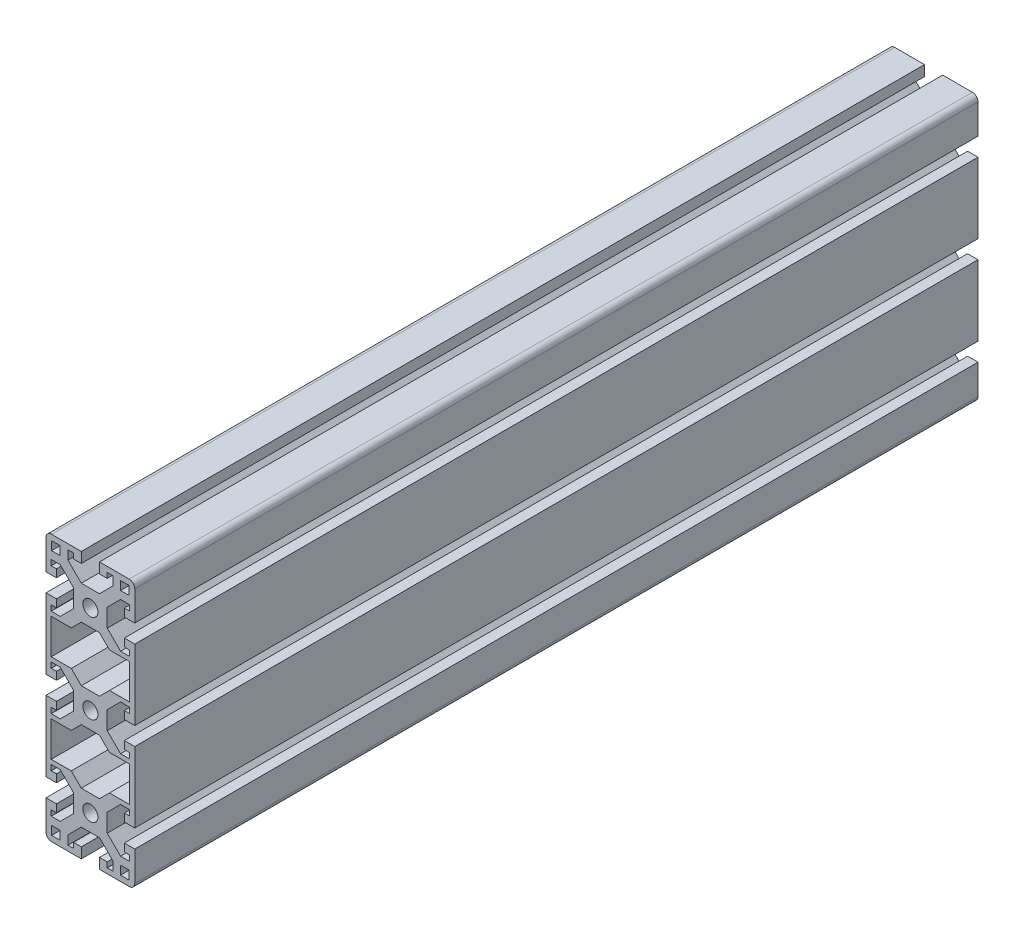
from build123d import *

# Parameters (mm, degrees)
SKETCH2_W                       = 3.9
SKETCH2_H                       = 3.9
F_40_SERIES_TS40_120LM_1_DEPTH  = 380
M8X1_25_TAPPED_HOLE1_AT_2_COUNT = 2
M8X1_25_TAPPED_HOLE1_AT_2_PITCH = 40
M8X1_25_TAPPED_HOLE1_AT_3_COUNT = 2
M8X1_25_TAPPED_HOLE1_AT_3_PITCH = 80


with BuildPart() as part:
    # Sketch2 → 40 series TS40-120LM(1) (new body)
    with BuildSketch(Plane.XY.offset(-190)):
        with BuildLine():
            Line((15.3, -35.9), (20, -35.9))
            Line((20, -35.9), (20, -4.1))
            Line((20, -4.1), (15.3, -4.1))
            Line((15.3, -4.1), (15.3, -7.6))
            Line((15.3, -7.6), (17.65, -7.6))
            Line((17.65, -7.6), (17.65, -10.1))
            Line((17.65, -10.1), (13.6, -10.1))
            Line((13.6, -10.1), (7.6, -4.1))
            Line((7.6, -4.1), (7.6, 4.1))
            Line((7.6, 4.1), (13.6, 10.1))
            Line((13.6, 10.1), (17.65, 10.1))
            Line((17.65, 10.1), (17.65, 7.6))
            Line((17.65, 7.6), (15.3, 7.6))
            Line((15.3, 7.6), (15.3, 4.1))
            Line((15.3, 4.1), (20, 4.1))
            Line((20, 4.1), (20, 35.9))
            Line((20, 35.9), (15.3, 35.9))
            Line((15.3, 35.9), (15.3, 32.4))
            Line((15.3, 32.4), (17.65, 32.4))
            Line((17.65, 32.4), (17.65, 29.9))
            Line((17.65, 29.9), (13.6, 29.9))
            Line((13.6, 29.9), (7.6, 35.9))
            Line((7.6, 35.9), (7.6, 44.1))
            Line((7.6, 44.1), (13.6, 50.1))
            Line((13.6, 50.1), (17.65, 50.1))
            Line((17.65, 50.1), (17.65, 47.6))
            Line((17.65, 47.6), (15.3, 47.6))
            Line((15.3, 47.6), (15.3, 44.1))
            Line((15.3, 44.1), (20, 44.1))
            Line((20, 44.1), (20, 57.5))
            ThreePointArc((20, 57.5), (19.267766953, 59.267766953), (17.5, 60))
            Line((17.5, 60), (4.1, 60))
            Line((4.1, 60), (4.1, 55.3))
            Line((4.1, 55.3), (7.6, 55.3))
            Line((7.6, 55.3), (7.6, 57.65))
            Line((7.6, 57.65), (10.1, 57.65))
            Line((10.1, 57.65), (10.1, 53.6))
            Line((10.1, 53.6), (4.1, 47.6))
            Line((4.1, 47.6), (-4.1, 47.6))
            Line((-4.1, 47.6), (-10.1, 53.6))
            Line((-10.1, 53.6), (-10.1, 57.65))
            Line((-10.1, 57.65), (-7.6, 57.65))
            Line((-7.6, 57.65), (-7.6, 55.3))
            Line((-7.6, 55.3), (-4.1, 55.3))
            Line((-4.1, 55.3), (-4.1, 60))
            Line((-4.1, 60), (-17.5, 60))
            ThreePointArc((-17.5, 60), (-19.267766953, 59.267766953), (-20, 57.5))
            Line((-20, 57.5), (-20, 44.1))
            Line((-20, 44.1), (-15.3, 44.1))
            Line((-15.3, 44.1), (-15.3, 47.6))
            Line((-15.3, 47.6), (-17.65, 47.6))
            Line((-17.65, 47.6), (-17.65, 50.1))
            Line((-17.65, 50.1), (-13.6, 50.1))
            Line((-13.6, 50.1), (-7.6, 44.1))
            Line((-7.6, 44.1), (-7.6, 35.9))
            Line((-7.6, 35.9), (-13.6, 29.9))
            Line((-13.6, 29.9), (-17.65, 29.9))
            Line((-17.65, 29.9), (-17.65, 32.4))
            Line((-17.65, 32.4), (-15.3, 32.4))
            Line((-15.3, 32.4), (-15.3, 35.9))
            Line((-15.3, 35.9), (-20, 35.9))
            Line((-20, 35.9), (-20, 4.1))
            Line((-20, 4.1), (-15.3, 4.1))
            Line((-15.3, 4.1), (-15.3, 7.6))
            Line((-15.3, 7.6), (-17.65, 7.6))
            Line((-17.65, 7.6), (-17.65, 10.1))
            Line((-17.65, 10.1), (-13.6, 10.1))
            Line((-13.6, 10.1), (-7.6, 4.1))
            Line((-7.6, 4.1), (-7.6, -4.1))
            Line((-7.6, -4.1), (-13.6, -10.1))
            Line((-13.6, -10.1), (-17.65, -10.1))
            Line((-17.65, -10.1), (-17.65, -7.6))
            Line((-17.65, -7.6), (-15.3, -7.6))
            Line((-15.3, -7.6), (-15.3, -4.1))
            Line((-15.3, -4.1), (-20, -4.1))
            Line((-20, -4.1), (-20, -35.9))
            Line((-20, -35.9), (-15.3, -35.9))
            Line((-15.3, -35.9), (-15.3, -32.4))
            Line((-15.3, -32.4), (-17.65, -32.4))
            Line((-17.65, -32.4), (-17.65, -29.9))
            Line((-17.65, -29.9), (-13.6, -29.9))
            Line((-13.6, -29.9), (-7.6, -35.9))
            Line((-7.6, -35.9), (-7.6, -44.1))
            Line((-7.6, -44.1), (-13.6, -50.1))
            Line((-13.6, -50.1), (-17.65, -50.1))
            Line((-17.65, -50.1), (-17.65, -47.6))
            Line((-17.65, -47.6), (-15.3, -47.6))
            Line((-15.3, -47.6), (-15.3, -44.1))
            Line((-15.3, -44.1), (-20, -44.1))
            Line((-20, -44.1), (-20, -57.5))
            ThreePointArc((-20, -57.5), (-19.267766953, -59.267766953), (-17.5, -60))
            Line((-17.5, -60), (-4.1, -60))
            Line((-4.1, -60), (-4.1, -55.3))
            Line((-4.1, -55.3), (-7.6, -55.3))
            Line((-7.6, -55.3), (-7.6, -57.65))
            Line((-7.6, -57.65), (-10.1, -57.65))
            Line((-10.1, -57.65), (-10.1, -53.6))
            Line((-10.1, -53.6), (-4.1, -47.6))
            Line((-4.1, -47.6), (4.1, -47.6))
            Line((4.1, -47.6), (10.1, -53.6))
            Line((10.1, -53.6), (10.1, -57.65))
            Line((10.1, -57.65), (7.6, -57.65))
            Line((7.6, -57.65), (7.6, -55.3))
            Line((7.6, -55.3), (4.1, -55.3))
            Line((4.1, -55.3), (4.1, -60))
            Line((4.1, -60), (17.5, -60))
            ThreePointArc((17.5, -60), (19.267766953, -59.267766953), (20, -57.5))
            Line((20, -57.5), (20, -44.1))
            Line((20, -44.1), (15.3, -44.1))
            Line((15.3, -44.1), (15.3, -47.6))
            Line((15.3, -47.6), (17.65, -47.6))
            Line((17.65, -47.6), (17.65, -50.1))
            Line((17.65, -50.1), (13.6, -50.1))
            Line((13.6, -50.1), (7.6, -44.1))
            Line((7.6, -44.1), (7.6, -35.9))
            Line((7.6, -35.9), (13.6, -29.9))
            Line((13.6, -29.9), (17.65, -29.9))
            Line((17.65, -29.9), (17.65, -32.4))
            Line((17.65, -32.4), (15.3, -32.4))
            Line((15.3, -32.4), (15.3, -35.9))
        make_face()
        Polygon((-4.1, -7.6), (4.1, -7.6), (8.6, -12.1), (17.65, -12.1), (17.65, -27.9), (8.6, -27.9), (4.1, -32.4), (-4.1, -32.4), (-8.6, -27.9), (-17.65, -27.9), (-17.65, -12.1), (-8.6, -12.1), align=None, mode=Mode.SUBTRACT)
        Polygon((-4.1, 7.6), (-8.6, 12.1), (-17.65, 12.1), (-17.65, 27.9), (-8.6, 27.9), (-4.1, 32.4), (4.1, 32.4), (8.6, 27.9), (17.65, 27.9), (17.65, 12.1), (8.6, 12.1), (4.1, 7.6), align=None, mode=Mode.SUBTRACT)
        with Locations((15.55, -55.55)):
            Rectangle(SKETCH2_W, SKETCH2_H, mode=Mode.SUBTRACT)
        with Locations((-15.55, -55.55)):
            Rectangle(SKETCH2_W, SKETCH2_H, mode=Mode.SUBTRACT)
        with Locations((-15.55, 55.55)):
            Rectangle(SKETCH2_W, SKETCH2_H, mode=Mode.SUBTRACT)
        with Locations((15.55, 55.55)):
            Rectangle(SKETCH2_W, SKETCH2_H, mode=Mode.SUBTRACT)
        with BuildLine():
            ThreePointArc((0, -43.35), (3.35, -40), (0, -36.65))
            ThreePointArc((0, -36.65), (-3.35, -40), (0, -43.35))
        make_face(mode=Mode.SUBTRACT)
        with BuildLine():
            ThreePointArc((3.35, 0), (0, -3.35), (-3.35, 0))
            ThreePointArc((-3.35, 0), (0, 3.35), (3.35, 0))
        make_face(mode=Mode.SUBTRACT)
        with BuildLine():
            ThreePointArc((0, 43.35), (-3.35, 40), (0, 36.65))
            ThreePointArc((0, 36.65), (3.35, 40), (0, 43.35))
        make_face(mode=Mode.SUBTRACT)
    extrude(amount=F_40_SERIES_TS40_120LM_1_DEPTH)

    # Sketch4 → M8x1.25 Tapped Hole1 (revolve, cut)
    with BuildSketch(Plane(origin=(0, 40, 190), x_dir=(0, -1, 0), z_dir=(1, 0, 0))):
        Polygon((0, 0), (0, 27.042926105), (3.4, 25), (3.4, 0), align=None)
    m8x1_25_tapped_hole1 = revolve(axis=Axis((0, 40, 196.35), (0, 0, -1)), mode=Mode.SUBTRACT)

    # M8x1.25 Tapped Hole1 at 2: M8x1.25 Tapped Hole1 ×2
    with Locations(*[(0, -i * M8X1_25_TAPPED_HOLE1_AT_2_PITCH, 0) for i in range(1, M8X1_25_TAPPED_HOLE1_AT_2_COUNT)]):
        add(m8x1_25_tapped_hole1, mode=Mode.SUBTRACT)

    # M8x1.25 Tapped Hole1 at 3: M8x1.25 Tapped Hole1 ×2
    with Locations(*[(0, -i * M8X1_25_TAPPED_HOLE1_AT_3_PITCH, 0) for i in range(1, M8X1_25_TAPPED_HOLE1_AT_3_COUNT)]):
        add(m8x1_25_tapped_hole1, mode=Mode.SUBTRACT)

    # Mirror1: M8x1.25 Tapped Hole1 across plane
    add(m8x1_25_tapped_hole1.mirror(Plane.XY), mode=Mode.SUBTRACT)

    # Mirror1 copy 1 sketch → Mirror1 copy 1 (revolve, cut)
    with BuildSketch(Plane(origin=(0, 0, -190), x_dir=(0, -1, 0), z_dir=(1, 0, 0))):
        Polygon((0, 0), (0, -27.042926105), (3.4, -25), (3.4, 0), align=None)
    revolve(axis=Axis((0, 0, -196.35), (0, 0, -1)), mode=Mode.SUBTRACT)

    # Mirror1 copy 2 sketch → Mirror1 copy 2 (revolve, cut)
    with BuildSketch(Plane(origin=(0, -40, -190), x_dir=(0, -1, 0), z_dir=(1, 0, 0))):
        Polygon((0, 0), (0, -27.042926105), (3.4, -25), (3.4, 0), align=None)
    revolve(axis=Axis((0, -40, -196.35), (0, 0, -1)), mode=Mode.SUBTRACT)


solid = part.part
